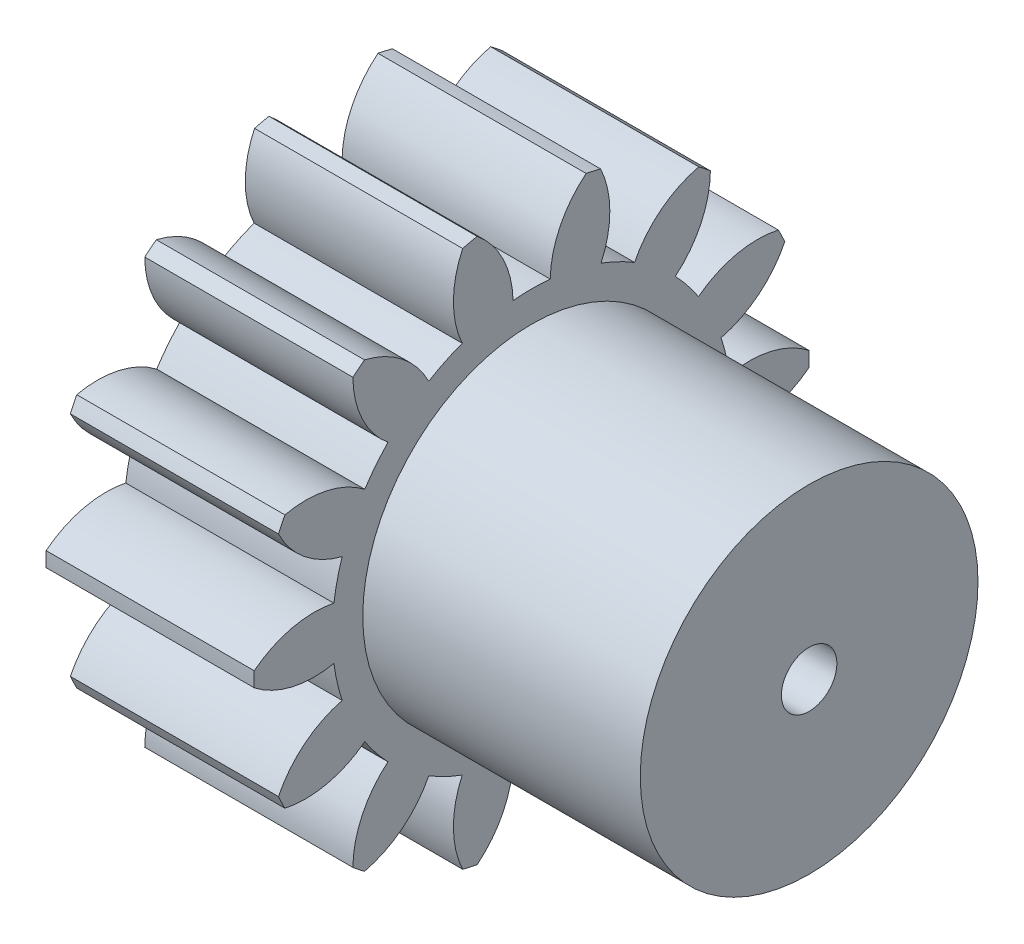
from build123d import *

# Parameters (mm, degrees)
BASPROSKE_W         = 15
BASPROSKE_H         = 20
TOOTHCUT_DEPTH      = 33.015621187
TEETHCUTS_COUNT     = 14
TEETHCUTS_ANGLE     = 334.285714286
BORSKE_R            = 2
BORE_DEPTH          = 50.0000508
SKETCH1_R           = 12.170076636
BOSS_EXTRUDE1_DEPTH = 20
SKETCH3_R           = 2
CUT_EXTRUDE1_DEPTH  = 45.828194428


with BuildPart() as part:
    # BasProSke → Base-Revolve (revolve)
    with BuildSketch(Plane(origin=(0, 0, 0), x_dir=(1, 0, 0), z_dir=(0, 1, 0)), mode=Mode.PRIVATE) as base_revolve_sk:
        with Locations((7.5, 10)):
            Rectangle(BASPROSKE_W, BASPROSKE_H)
    revolve(base_revolve_sk.sketch.rotate(Axis((-10, 0, 0), (1, 0, 0)), 180), axis=Axis((-10, 0, 0), (1, 0, 0)))

    # TooCutSke → ToothCut (cut, through all)
    with BuildSketch(Plane(origin=(0, 0, 0), x_dir=(0, 0, -1), z_dir=(1, 0, 0))):
        with BuildLine():
            ThreePointArc((1.339503949, 14.311450142), (0, 14.374), (-1.339503949, 14.311450142))
            ThreePointArc((-1.339503949, 14.311450142), (-2.055976555, 17.261705303), (-3.954182827, 19.631125371))
            ThreePointArc((-3.954182827, 19.631125371), (0, 20.0254), (3.954182827, 19.631125371))
            ThreePointArc((3.954182827, 19.631125371), (2.055976555, 17.261705303), (1.339503949, 14.311450142))
        make_face()
    toothcut = extrude(amount=TOOTHCUT_DEPTH, mode=Mode.SUBTRACT)

    # TeethCuts: ToothCut ×14 about axis
    teethcuts_axis = Axis((-10, 0, 0), (1, 0, 0))
    for i in range(1, TEETHCUTS_COUNT):
        add(toothcut.rotate(teethcuts_axis, i * TEETHCUTS_ANGLE / (TEETHCUTS_COUNT - 1)), mode=Mode.SUBTRACT)

    # BorSke → Bore (cut, symmetric)
    with BuildSketch(Plane(origin=(0, 0, 0), x_dir=(0, 0, -1), z_dir=(1, 0, 0))):
        with Locations(Location((0, 0, 0), (0, 0, 180))):
            Circle(BORSKE_R)
    extrude(amount=BORE_DEPTH, both=True, mode=Mode.SUBTRACT)

    # Sketch1 → Boss-Extrude1 (add)
    with BuildSketch(Plane(origin=(15, 0, 0), x_dir=(0, 0, -1), z_dir=(1, 0, 0))):
        with Locations(Location((0, 0, 0), (0, 0, 180))):
            Circle(SKETCH1_R)
    extrude(amount=BOSS_EXTRUDE1_DEPTH)

    # Sketch3 → Cut-Extrude1 (cut, through all)
    with BuildSketch(Plane(origin=(35, 0, 0), x_dir=(0, 0, -1), z_dir=(1, 0, 0))):
        Circle(SKETCH3_R)
    extrude(amount=-CUT_EXTRUDE1_DEPTH, mode=Mode.SUBTRACT)


solid = part.part
